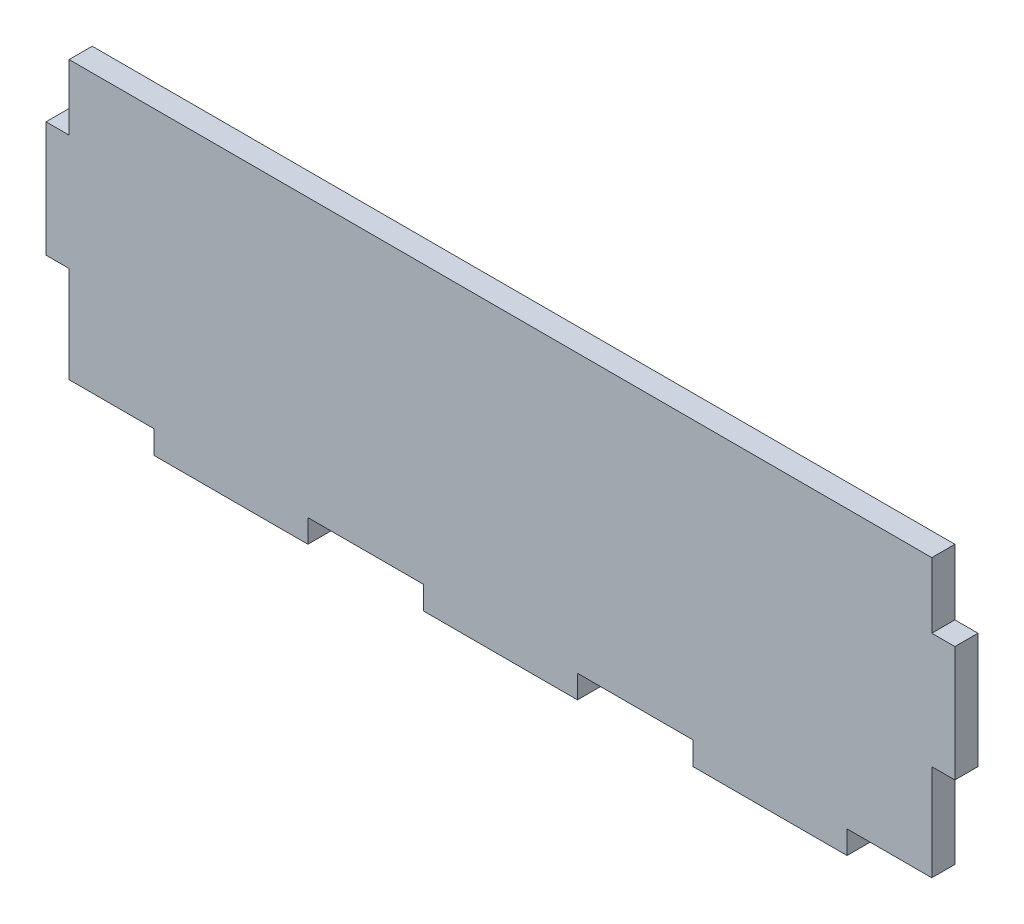
from build123d import *

# Parameters (mm, degrees)
SKETCH1_W           = 3
SKETCH1_H           = 15
SKETCH1_W_2         = 112
SKETCH1_H_2         = 40
SKETCH1_W_3         = 20
SKETCH1_H_3         = 3
BOSS_EXTRUDE1_DEPTH = 3
SKETCH2_W           = 112
SKETCH2_H           = 4
CUT_EXTRUDE1_DEPTH  = 3


with BuildPart() as part:
    # Sketch1 → Boss-Extrude1 (new body)
    with BuildSketch(Plane.XY):
        with Locations((-57.5, 0)):
            Rectangle(SKETCH1_W, SKETCH1_H)
        Rectangle(SKETCH1_W_2, SKETCH1_H_2)
        with Locations((-35, -21.5)):
            Rectangle(SKETCH1_W_3, SKETCH1_H_3)
        with Locations((0, -21.5)):
            Rectangle(SKETCH1_W_3, SKETCH1_H_3)
        with Locations((35, -21.5)):
            Rectangle(SKETCH1_W_3, SKETCH1_H_3)
        with Locations((57.5, 0)):
            Rectangle(SKETCH1_W, SKETCH1_H)
    extrude(amount=BOSS_EXTRUDE1_DEPTH)

    # Sketch2 → Cut-Extrude1 (cut)
    with BuildSketch(Plane.XY.offset(3)):
        with Locations((0, 18)):
            Rectangle(SKETCH2_W, SKETCH2_H)
    extrude(amount=-CUT_EXTRUDE1_DEPTH, mode=Mode.SUBTRACT)


solid = part.part
